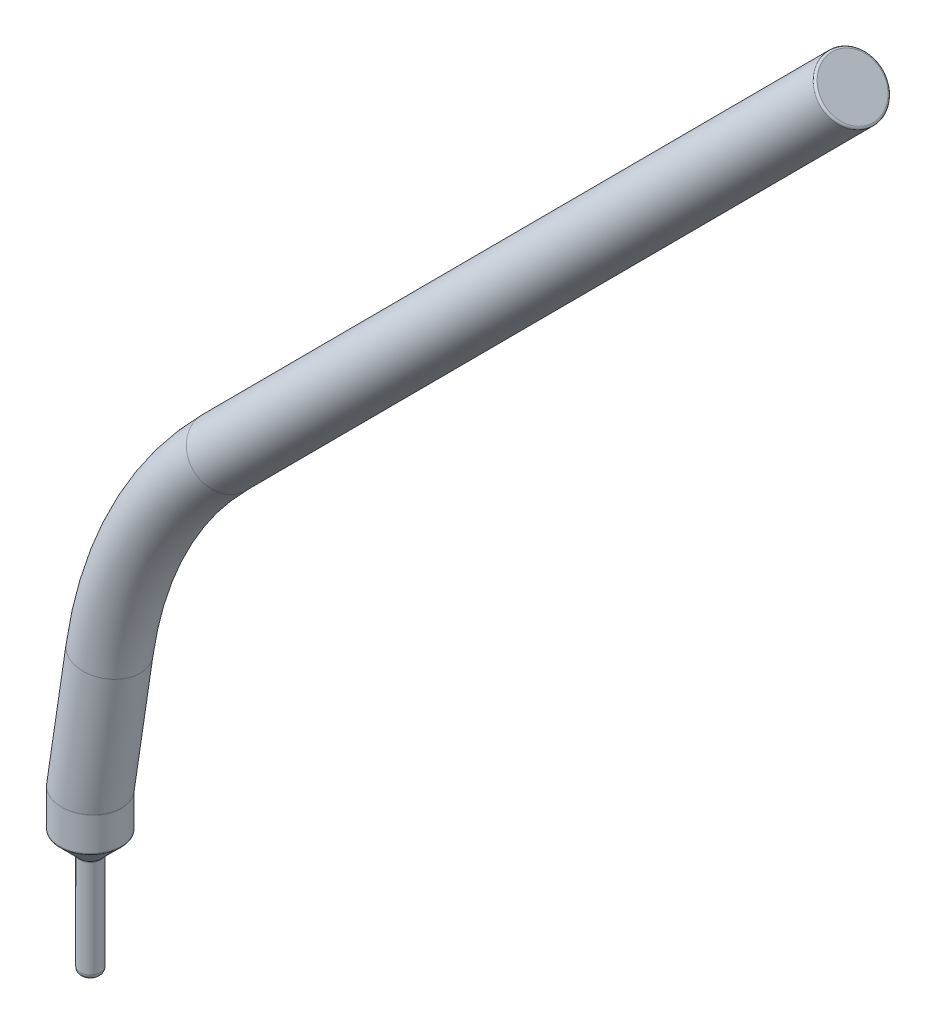
from build123d import *

# Parameters (mm, degrees)
SKETCH1_R           = 1.5
SKETCH3_R           = 0.5
BOSS_EXTRUDE1_DEPTH = 5
FILLET3_R           = 0.25
FILLET4_R           = 0.1
FILLET5_R           = 0.1


with BuildPart() as part:
    # Sweep1: sweep along a path in Sketch2
    with BuildLine(Plane.XY) as sweep1_path:
        Line((0, 0), (0, 1.73610206))
        Line((0, 1.73610206), (0.925407967, 7.964634839))
        ThreePointArc((0.925407967, 7.964634839), (2.817194406, 13.942096973), (6.483252605, 19.028247459))
        Line((6.483252605, 19.028247459), (36.887428436, 49.54436271))
    # Sketch1 → Sweep1 (sweep)
    with BuildSketch(Plane(origin=(0, 0, 0), x_dir=(1, 0, 0), z_dir=(0, 1, 0))):
        Circle(SKETCH1_R)
    sweep(path=sweep1_path.line, transition=Transition.RIGHT)



with BuildPart() as body_2:
    # Sketch3 → Boss-Extrude1 (new body)
    with BuildSketch(Plane(origin=(0, -1, 0), x_dir=(-1, 0, 0), z_dir=(0, -1, 0))):
        with Locations(Location((0, 0, 0), (0, 0, 90))):
            Circle(SKETCH3_R)
    extrude(amount=BOSS_EXTRUDE1_DEPTH)


with BuildPart() as part_1:
    add(part.part)

    add(body_2.part)  # loft1 joins it to this body
    # loft from a face of the part (loft1)
    loft([part_1.faces().sort_by_distance((0, 0, 0))[0], part_1.faces().sort_by_distance((0, -1, 0))[0]])

    # Fillet3
    fillet3_edges = [part_1.edges().sort_by_distance(p)[0] for p in [
        (0, -6, 0.5),
    ]]
    fillet(fillet3_edges, radius=FILLET3_R)

    # Fillet4
    fillet4_edges = [part_1.edges().sort_by_distance(p)[0] for p in [
        (-1.5, 0, 0),
        (35.824821123, 50.603072159, 0),
    ]]
    fillet(fillet4_edges, radius=FILLET4_R)

    # Fillet5
    fillet5_edges = [part_1.edges().sort_by_distance(p)[0] for p in [
        (0.353553391, -1, -0.353553391),
    ]]
    fillet(fillet5_edges, radius=FILLET5_R)


solid = part_1.part
